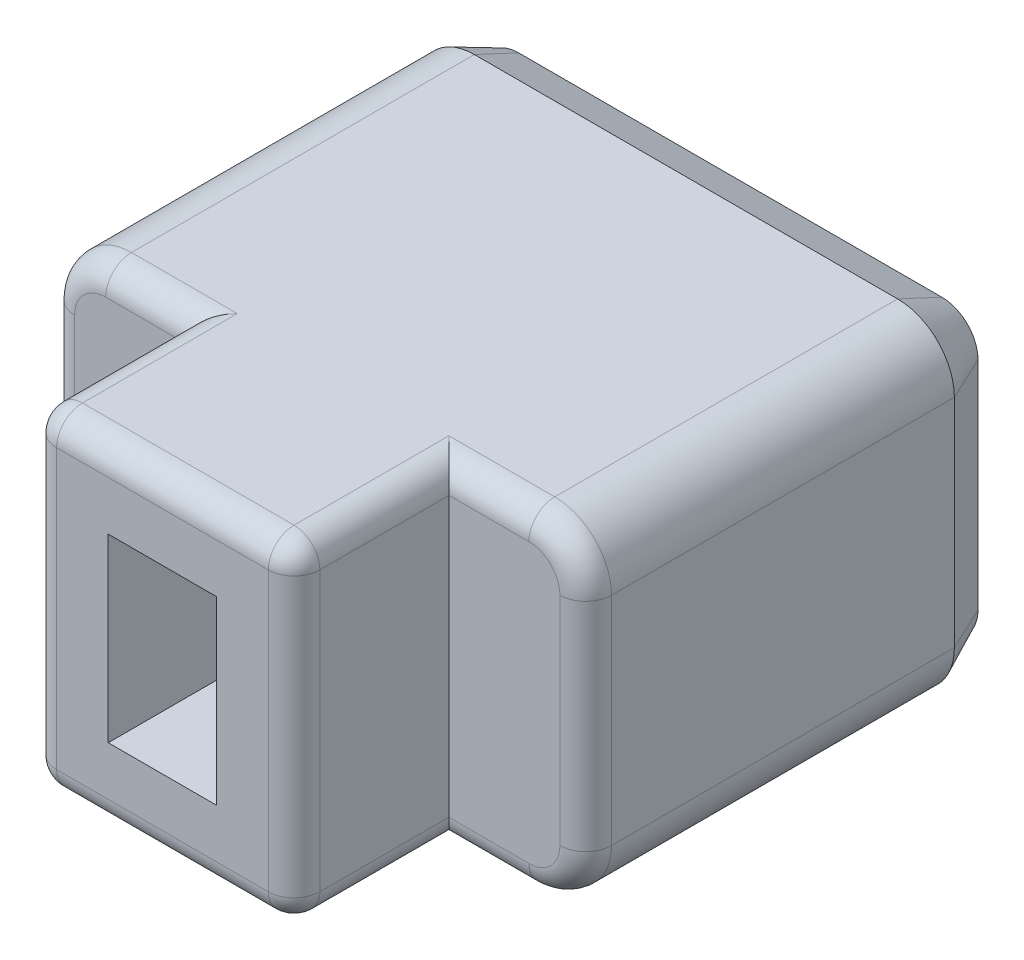
from build123d import *

# Parameters (mm, degrees)
BOSS_EXTRU_1_DEPTH      = 11
ESQUISSE3_W             = 2.1
ESQUISSE3_H             = 3.5
ENL_V_MAT_EXTRU_1_DEPTH = 3
ESQUISSE4_OUTSIDE_W     = 15.688
ESQUISSE4_OUTSIDE_H     = 11.688
ESQUISSE4_OUTSIDE_W_2   = 5.1
ESQUISSE4_OUTSIDE_H_2   = 6.4
ENL_V_MAT_EXTRU_2_DEPTH = 3
CONG_1_R                = 0.5
CHANFREIN1_SIZE         = 0.4
CHANFREIN1_SIZE2        = 0.857802768
ENL_V_MAT_EXTRU_3_DEPTH = 0.3
BOSS_EXTRU_2_DEPTH      = 0.3


with BuildPart() as part:
    # Esquisse2 → Boss.-Extru.1 (new body)
    with BuildSketch(Plane.XY):
        with BuildLine():
            Line((1.1, 0), (9.3, 0))
            ThreePointArc((9.3, 0), (10.077817459, 0.322182541), (10.4, 1.1))
            Line((10.4, 1.1), (10.4, 5.3))
            ThreePointArc((10.4, 5.3), (10.077817459, 6.077817459), (9.3, 6.4))
            Line((9.3, 6.4), (1.1, 6.4))
            ThreePointArc((1.1, 6.4), (0.322182541, 6.077817459), (0, 5.3))
            Line((0, 5.3), (0, 1.1))
            ThreePointArc((0, 1.1), (0.322182541, 0.322182541), (1.1, 0))
        make_face()
    extrude(amount=BOSS_EXTRU_1_DEPTH)

    # Esquisse3 → Enlèv. mat.-Extru.1 (cut)
    with BuildSketch(Plane.XY.offset(11)):
        with Locations((5.2, 3.2)):
            Rectangle(ESQUISSE3_W, ESQUISSE3_H)
    extrude(amount=-ENL_V_MAT_EXTRU_1_DEPTH, mode=Mode.SUBTRACT)

    # Esquisse4 outside → Enlèv. mat.-Extru.2 (cut)
    with BuildSketch(Plane.XY.offset(11)):
        with Locations((5.2, 3.2)):
            Rectangle(ESQUISSE4_OUTSIDE_W, ESQUISSE4_OUTSIDE_H)
        with Locations((5.2, 3.2)):
            Rectangle(ESQUISSE4_OUTSIDE_W_2, ESQUISSE4_OUTSIDE_H_2, mode=Mode.SUBTRACT)
    extrude(amount=-ENL_V_MAT_EXTRU_2_DEPTH, mode=Mode.SUBTRACT)

    # Congé1
    cong_1_edges = [part.edges().sort_by_distance(p)[0] for p in [
        (8.525, 0, 8),
        (10.077817459, 0.322182541, 8),
        (10.4, 3.2, 8),
        (10.077817459, 6.077817459, 8),
        (1.875, 6.4, 8),
        (0.322182541, 6.077817459, 8),
        (1.875, 0, 8),
        (0.322182541, 0.322182541, 8),
        (7.75, 6.4, 9.5),
        (2.65, 6.4, 9.5),
        (7.75, 0, 9.5),
        (2.65, 0, 9.5),
        (2.65, 3.2, 11),
        (5.2, 6.4, 11),
        (7.75, 3.2, 11),
        (5.2, 0, 11),
        (8.525, 6.4, 8),
        (0, 3.2, 8),
    ]]
    fillet(cong_1_edges, radius=CONG_1_R)

    # Chanfrein1
    chanfrein1_edges = [part.edges().sort_by_distance(p)[0] for p in [
        (5.2, 0, 0),
        (10.077817459, 0.322182541, 0),
        (0.322182541, 0.322182541, 0),
        (10.4, 3.2, 0),
        (0, 3.2, 0),
        (10.077817459, 6.077817459, 0),
        (0.322182541, 6.077817459, 0),
        (5.2, 6.4, 0),
    ]]
    chanfrein1_side = [part.faces().sort_by_distance(p)[0] for p in [
        (5.2, 3.2, 0),
    ]]
    chamfer(chanfrein1_edges, length=CHANFREIN1_SIZE, length2=CHANFREIN1_SIZE2, reference=chanfrein1_side[0])

    # Esquisse5 → Enlèv. mat.-Extru.3 (cut)
    with BuildSketch(Plane(origin=(0, 0, 0), x_dir=(-1, 0, 0), z_dir=(0, 0, -1))):
        with BuildLine():
            Line((-4.482051282, 2.223076923), (-4.123076923, 2.223076923))
            add(Edge.make_bspline(
                [(-4.123076923, 2.223076923), (-4.132172802, 2.182879821), (-4.149904355, 2.104519386), (-4.184689712, 1.991513998), (-4.225434495, 1.885765982), (-4.271957447, 1.78691387), (-4.323886866, 1.694871968), (-4.383007257, 1.610659662), (-4.446581457, 1.532228116), (-4.517727797, 1.463096907), (-4.591770568, 1.39996683), (-4.670710111, 1.346640876), (-4.752169587, 1.300230117), (-4.83719503, 1.262457843), (-4.925900563, 1.233638239), (-5.017876741, 1.21280939), (-5.113071631, 1.199496847), (-5.177787354, 1.198126712), (-5.210416667, 1.197435897)],
                knots=[0, 0, 0, 0, 1.213646873, 2.365889363, 3.479226314, 4.54912843, 5.581579656, 6.587705624, 7.576924878, 8.55050232, 9.505464024, 10.439453725, 11.351887816, 12.264152294, 13.174752891, 14.094686289, 15.039351257, 16, 16, 16, 16], degree=3))
            add(Edge.make_bspline(
                [(-5.210416667, 1.197435897), (-5.258094164, 1.199027149), (-5.352644116, 1.202182785), (-5.491403374, 1.230611249), (-5.625136021, 1.275963762), (-5.7524842, 1.338183678), (-5.870766075, 1.415281732), (-5.976128691, 1.506523979), (-6.066425025, 1.611076421), (-6.142330911, 1.726114044), (-6.202133725, 1.848818877), (-6.244814609, 1.975692907), (-6.271762849, 2.105224606), (-6.275198805, 2.192767116), (-6.276923077, 2.236698718)],
                knots=[0, 0, 0, 0, 1.037361841, 2.057207614, 3.07074694, 4.106133614, 5.135440569, 6.137362823, 7.131079132, 8.134553603, 9.130922184, 10.094788979, 11.043904817, 12, 12, 12, 12], degree=3))
            add(Edge.make_bspline(
                [(-6.276923077, 2.236698718), (-6.275539605, 2.278987452), (-6.272833897, 2.361693152), (-6.251540773, 2.482378728), (-6.216237816, 2.596400166), (-6.166137783, 2.703538574), (-6.102114735, 2.804087582), (-6.023690642, 2.897152494), (-5.931612715, 2.984047443), (-5.86169914, 3.033978011), (-5.825801282, 3.059615385)],
                knots=[0, 0, 0, 0, 1.034740432, 2.023681557, 2.989439786, 3.948891607, 4.910213012, 5.898894732, 6.921165452, 8, 8, 8, 8], degree=3))
            add(Edge.make_bspline(
                [(-5.825801282, 3.059615385), (-5.864137499, 3.080191012), (-5.940809934, 3.121342266), (-6.043507734, 3.202018162), (-6.138023166, 3.293734818), (-6.189768342, 3.364866735), (-6.216025641, 3.400961538)],
                knots=[0, 0, 0, 0, 0.994607769, 1.989215539, 2.979658163, 4, 4, 4, 4], degree=3))
            add(Edge.make_bspline(
                [(-6.216025641, 3.400961538), (-6.233356316, 3.427373686), (-6.26787002, 3.479972967), (-6.310391281, 3.563667495), (-6.347879736, 3.649096513), (-6.37822649, 3.736968961), (-6.401497955, 3.827322661), (-6.418276255, 3.919969224), (-6.429147626, 4.015018145), (-6.430226667, 4.079350901), (-6.430769231, 4.111698718)],
                knots=[0, 0, 0, 0, 1.00515716, 2.001751025, 2.984458985, 3.97420733, 4.958128942, 5.952324961, 6.970387383, 8, 8, 8, 8], degree=3))
            add(Edge.make_bspline(
                [(-6.430769231, 4.111698718), (-6.428743989, 4.167663613), (-6.42471183, 4.279086982), (-6.392790373, 4.444008829), (-6.342381333, 4.604955427), (-6.27195412, 4.75956667), (-6.18482671, 4.904129083), (-6.081145827, 5.033094403), (-5.962534477, 5.144582643), (-5.830197653, 5.237360691), (-5.68630887, 5.311534147), (-5.532868345, 5.364666879), (-5.370679404, 5.396859709), (-5.259709965, 5.400639474), (-5.203205128, 5.402564103)],
                knots=[0, 0, 0, 0, 1.014706638, 2.020231274, 3.036313833, 4.068571099, 5.094908553, 6.090824756, 7.060992088, 8.038345228, 9.013581893, 9.988228495, 10.975620497, 12, 12, 12, 12], degree=3))
            add(Edge.make_bspline(
                [(-5.203205128, 5.402564103), (-5.165246363, 5.401570424), (-5.090682463, 5.399618502), (-4.9810235, 5.386317129), (-4.876778256, 5.361480703), (-4.776379933, 5.330186609), (-4.681760311, 5.286956208), (-4.591303684, 5.235671401), (-4.506016772, 5.174294586), (-4.425884157, 5.103608562), (-4.351166433, 5.024051615), (-4.282737635, 4.935670934), (-4.222178503, 4.838072885), (-4.166983575, 4.732595618), (-4.120271063, 4.617488155), (-4.079407489, 4.494143595), (-4.045544141, 4.361842187), (-4.029014069, 4.270204999), (-4.020512821, 4.223076923)],
                knots=[0, 0, 0, 0, 0.990568784, 1.945813299, 2.875676271, 3.783761552, 4.685324092, 5.584377753, 6.493425385, 7.4218245, 8.36851308, 9.337390209, 10.333265409, 11.361963029, 12.440115797, 13.570763079, 14.750668092, 16, 16, 16, 16], degree=3))
            Line((-4.020512821, 4.223076923), (-4.379487179, 4.223076923))
            add(Edge.make_bspline(
                [(-4.379487179, 4.223076923), (-4.387118243, 4.253901726), (-4.401958094, 4.313845598), (-4.429866947, 4.399311139), (-4.45787412, 4.47900565), (-4.490311856, 4.551314604), (-4.524644529, 4.617265759), (-4.561464259, 4.677017538), (-4.601146872, 4.729940781), (-4.630535719, 4.760986514), (-4.644711538, 4.775961538)],
                knots=[0, 0, 0, 0, 1.227409514, 2.386898646, 3.474821375, 4.49196229, 5.448190758, 6.348047463, 7.203174547, 8, 8, 8, 8], degree=3))
            add(Edge.make_bspline(
                [(-4.644711538, 4.775961538), (-4.663625825, 4.793169329), (-4.701087137, 4.827250782), (-4.76262788, 4.8714789), (-4.82763193, 4.909502151), (-4.896789588, 4.939903316), (-4.969627615, 4.963233834), (-5.046089988, 4.979888915), (-5.126502917, 4.990788894), (-5.18153399, 4.991794533), (-5.209615385, 4.992307692)],
                knots=[0, 0, 0, 0, 0.987673777, 1.956169713, 2.922958465, 3.893597884, 4.869766497, 5.874185781, 6.915234169, 8, 8, 8, 8], degree=3))
            add(Edge.make_bspline(
                [(-5.209615385, 4.992307692), (-5.241448955, 4.991621354), (-5.303484394, 4.990283856), (-5.39400022, 4.977425049), (-5.480036376, 4.959232218), (-5.560686962, 4.930153903), (-5.637551649, 4.895417149), (-5.708737853, 4.850964488), (-5.775216799, 4.799002976), (-5.836422077, 4.74018012), (-5.89108324, 4.675557144), (-5.939388385, 4.608069597), (-5.980982451, 4.538169232), (-6.013333239, 4.464646611), (-6.040538243, 4.389136122), (-6.058770549, 4.310341705), (-6.069136276, 4.228963731), (-6.070902137, 4.173960727), (-6.071794872, 4.146153846)],
                knots=[0, 0, 0, 0, 1.131388683, 2.204785482, 3.246441662, 4.252851856, 5.247356788, 6.241181003, 7.22926868, 8.243715995, 9.254465245, 10.235036049, 11.192984918, 12.141087045, 13.087426855, 14.043631555, 15.010953923, 16, 16, 16, 16], degree=3))
            add(Edge.make_bspline(
                [(-6.071794872, 4.146153846), (-6.070425424, 4.108923192), (-6.06770243, 4.034894228), (-6.045263849, 3.925951777), (-6.008784671, 3.820693552), (-5.958785101, 3.720677931), (-5.896401591, 3.62841055), (-5.823392741, 3.547133882), (-5.740422622, 3.477841607), (-5.662765755, 3.43054886), (-5.593787365, 3.398821262), (-5.535204528, 3.377096108), (-5.469607981, 3.359132482), (-5.398017693, 3.342329942), (-5.319417432, 3.327809305), (-5.234365734, 3.316175248), (-5.142449502, 3.306375708), (-5.079025259, 3.302176407), (-5.046153846, 3.3)],
                knots=[0, 0, 0, 0, 1.192805178, 2.371758753, 3.549810072, 4.756155874, 5.946098869, 7.110280517, 8.247279574, 9.400162675, 10.013208869, 10.679725361, 11.400782005, 12.192190353, 13.037020936, 13.96226458, 14.943885823, 16, 16, 16, 16], degree=3))
            Line((-5.046153846, 3.3), (-5.046153846, 2.88974359))
            add(Edge.make_bspline(
                [(-5.046153846, 2.88974359), (-5.088150562, 2.888762199), (-5.170660543, 2.886834082), (-5.291308641, 2.868815079), (-5.406306817, 2.839057635), (-5.513901263, 2.797793619), (-5.611837507, 2.748050326), (-5.697356677, 2.691251666), (-5.767743193, 2.626744832), (-5.823945861, 2.556359146), (-5.865824484, 2.480980159), (-5.89566742, 2.40214926), (-5.91522079, 2.319915292), (-5.917034619, 2.263518126), (-5.917948718, 2.235096154)],
                knots=[0, 0, 0, 0, 1.243616131, 2.44330398, 3.604505843, 4.75669394, 5.850271017, 6.853290421, 7.788562808, 8.667255455, 9.510416964, 10.331949075, 11.159367386, 12, 12, 12, 12], degree=3))
            add(Edge.make_bspline(
                [(-5.917948718, 2.235096154), (-5.91735912, 2.214221522), (-5.916188689, 2.172782552), (-5.906034732, 2.111908452), (-5.891099605, 2.052952656), (-5.869264862, 1.996484401), (-5.840766114, 1.942387341), (-5.80637209, 1.890106875), (-5.764855489, 1.840569584), (-5.7192227, 1.792655284), (-5.667906556, 1.74940941), (-5.612600183, 1.712031857), (-5.554359317, 1.679379127), (-5.492850933, 1.6530839), (-5.42784051, 1.632866221), (-5.359681028, 1.618661468), (-5.288113774, 1.609612794), (-5.239290185, 1.608340381), (-5.214423077, 1.607692308)],
                knots=[0, 0, 0, 0, 0.95422432, 1.894264499, 2.815862866, 3.732507896, 4.656047834, 5.60823639, 6.589073805, 7.608638867, 8.631711616, 9.651715799, 10.65801814, 11.681528505, 12.705549186, 13.767074307, 14.862713597, 16, 16, 16, 16], degree=3))
            add(Edge.make_bspline(
                [(-5.214423077, 1.607692308), (-5.174463142, 1.609275267), (-5.096292971, 1.612371873), (-4.983725649, 1.639891651), (-4.879168109, 1.683156126), (-4.800266567, 1.735429254), (-4.742005947, 1.786360527), (-4.699530846, 1.830715578), (-4.658184177, 1.880805783), (-4.619294171, 1.937517388), (-4.582737756, 2.0006376), (-4.546195196, 2.068600834), (-4.512748799, 2.143503144), (-4.492494915, 2.196005048), (-4.482051282, 2.223076923)],
                knots=[0, 0, 0, 0, 1.395667895, 2.730224622, 4.027984045, 5.336391174, 6.018318975, 6.731826814, 7.481767641, 8.28762907, 9.133535766, 10.031970229, 10.985212891, 12, 12, 12, 12], degree=3))
        make_face()
    extrude(amount=-ENL_V_MAT_EXTRU_3_DEPTH, mode=Mode.SUBTRACT)


with BuildPart() as body_2:
    # Esquisse5<2> → Boss.-Extru.2 (new body)
    with BuildSketch(Plane(origin=(0, 0, 0), x_dir=(-1, 0, 0), z_dir=(0, 0, -1))):
        with BuildLine():
            Line((-4.482051282, 2.223076923), (-4.123076923, 2.223076923))
            add(Edge.make_bspline(
                [(-4.123076923, 2.223076923), (-4.132172802, 2.182879821), (-4.149904355, 2.104519386), (-4.184689712, 1.991513998), (-4.225434495, 1.885765982), (-4.271957447, 1.78691387), (-4.323886866, 1.694871968), (-4.383007257, 1.610659662), (-4.446581457, 1.532228116), (-4.517727797, 1.463096907), (-4.591770568, 1.39996683), (-4.670710111, 1.346640876), (-4.752169587, 1.300230117), (-4.83719503, 1.262457843), (-4.925900563, 1.233638239), (-5.017876741, 1.21280939), (-5.113071631, 1.199496847), (-5.177787354, 1.198126712), (-5.210416667, 1.197435897)],
                knots=[0, 0, 0, 0, 1.213646873, 2.365889363, 3.479226314, 4.54912843, 5.581579656, 6.587705624, 7.576924878, 8.55050232, 9.505464024, 10.439453725, 11.351887816, 12.264152294, 13.174752891, 14.094686289, 15.039351257, 16, 16, 16, 16], degree=3))
            add(Edge.make_bspline(
                [(-5.210416667, 1.197435897), (-5.258094164, 1.199027149), (-5.352644116, 1.202182785), (-5.491403374, 1.230611249), (-5.625136021, 1.275963762), (-5.7524842, 1.338183678), (-5.870766075, 1.415281732), (-5.976128691, 1.506523979), (-6.066425025, 1.611076421), (-6.142330911, 1.726114044), (-6.202133725, 1.848818877), (-6.244814609, 1.975692907), (-6.271762849, 2.105224606), (-6.275198805, 2.192767116), (-6.276923077, 2.236698718)],
                knots=[0, 0, 0, 0, 1.037361841, 2.057207614, 3.07074694, 4.106133614, 5.135440569, 6.137362823, 7.131079132, 8.134553603, 9.130922184, 10.094788979, 11.043904817, 12, 12, 12, 12], degree=3))
            add(Edge.make_bspline(
                [(-6.276923077, 2.236698718), (-6.275539605, 2.278987452), (-6.272833897, 2.361693152), (-6.251540773, 2.482378728), (-6.216237816, 2.596400166), (-6.166137783, 2.703538574), (-6.102114735, 2.804087582), (-6.023690642, 2.897152494), (-5.931612715, 2.984047443), (-5.86169914, 3.033978011), (-5.825801282, 3.059615385)],
                knots=[0, 0, 0, 0, 1.034740432, 2.023681557, 2.989439786, 3.948891607, 4.910213012, 5.898894732, 6.921165452, 8, 8, 8, 8], degree=3))
            add(Edge.make_bspline(
                [(-5.825801282, 3.059615385), (-5.864137499, 3.080191012), (-5.940809934, 3.121342266), (-6.043507734, 3.202018162), (-6.138023166, 3.293734818), (-6.189768342, 3.364866735), (-6.216025641, 3.400961538)],
                knots=[0, 0, 0, 0, 0.994607769, 1.989215539, 2.979658163, 4, 4, 4, 4], degree=3))
            add(Edge.make_bspline(
                [(-6.216025641, 3.400961538), (-6.233356316, 3.427373686), (-6.26787002, 3.479972967), (-6.310391281, 3.563667495), (-6.347879736, 3.649096513), (-6.37822649, 3.736968961), (-6.401497955, 3.827322661), (-6.418276255, 3.919969224), (-6.429147626, 4.015018145), (-6.430226667, 4.079350901), (-6.430769231, 4.111698718)],
                knots=[0, 0, 0, 0, 1.00515716, 2.001751025, 2.984458985, 3.97420733, 4.958128942, 5.952324961, 6.970387383, 8, 8, 8, 8], degree=3))
            add(Edge.make_bspline(
                [(-6.430769231, 4.111698718), (-6.428743989, 4.167663613), (-6.42471183, 4.279086982), (-6.392790373, 4.444008829), (-6.342381333, 4.604955427), (-6.27195412, 4.75956667), (-6.18482671, 4.904129083), (-6.081145827, 5.033094403), (-5.962534477, 5.144582643), (-5.830197653, 5.237360691), (-5.68630887, 5.311534147), (-5.532868345, 5.364666879), (-5.370679404, 5.396859709), (-5.259709965, 5.400639474), (-5.203205128, 5.402564103)],
                knots=[0, 0, 0, 0, 1.014706638, 2.020231274, 3.036313833, 4.068571099, 5.094908553, 6.090824756, 7.060992088, 8.038345228, 9.013581893, 9.988228495, 10.975620497, 12, 12, 12, 12], degree=3))
            add(Edge.make_bspline(
                [(-5.203205128, 5.402564103), (-5.165246363, 5.401570424), (-5.090682463, 5.399618502), (-4.9810235, 5.386317129), (-4.876778256, 5.361480703), (-4.776379933, 5.330186609), (-4.681760311, 5.286956208), (-4.591303684, 5.235671401), (-4.506016772, 5.174294586), (-4.425884157, 5.103608562), (-4.351166433, 5.024051615), (-4.282737635, 4.935670934), (-4.222178503, 4.838072885), (-4.166983575, 4.732595618), (-4.120271063, 4.617488155), (-4.079407489, 4.494143595), (-4.045544141, 4.361842187), (-4.029014069, 4.270204999), (-4.020512821, 4.223076923)],
                knots=[0, 0, 0, 0, 0.990568784, 1.945813299, 2.875676271, 3.783761552, 4.685324092, 5.584377753, 6.493425385, 7.4218245, 8.36851308, 9.337390209, 10.333265409, 11.361963029, 12.440115797, 13.570763079, 14.750668092, 16, 16, 16, 16], degree=3))
            Line((-4.020512821, 4.223076923), (-4.379487179, 4.223076923))
            add(Edge.make_bspline(
                [(-4.379487179, 4.223076923), (-4.387118243, 4.253901726), (-4.401958094, 4.313845598), (-4.429866947, 4.399311139), (-4.45787412, 4.47900565), (-4.490311856, 4.551314604), (-4.524644529, 4.617265759), (-4.561464259, 4.677017538), (-4.601146872, 4.729940781), (-4.630535719, 4.760986514), (-4.644711538, 4.775961538)],
                knots=[0, 0, 0, 0, 1.227409514, 2.386898646, 3.474821375, 4.49196229, 5.448190758, 6.348047463, 7.203174547, 8, 8, 8, 8], degree=3))
            add(Edge.make_bspline(
                [(-4.644711538, 4.775961538), (-4.663625825, 4.793169329), (-4.701087137, 4.827250782), (-4.76262788, 4.8714789), (-4.82763193, 4.909502151), (-4.896789588, 4.939903316), (-4.969627615, 4.963233834), (-5.046089988, 4.979888915), (-5.126502917, 4.990788894), (-5.18153399, 4.991794533), (-5.209615385, 4.992307692)],
                knots=[0, 0, 0, 0, 0.987673777, 1.956169713, 2.922958465, 3.893597884, 4.869766497, 5.874185781, 6.915234169, 8, 8, 8, 8], degree=3))
            add(Edge.make_bspline(
                [(-5.209615385, 4.992307692), (-5.241448955, 4.991621354), (-5.303484394, 4.990283856), (-5.39400022, 4.977425049), (-5.480036376, 4.959232218), (-5.560686962, 4.930153903), (-5.637551649, 4.895417149), (-5.708737853, 4.850964488), (-5.775216799, 4.799002976), (-5.836422077, 4.74018012), (-5.89108324, 4.675557144), (-5.939388385, 4.608069597), (-5.980982451, 4.538169232), (-6.013333239, 4.464646611), (-6.040538243, 4.389136122), (-6.058770549, 4.310341705), (-6.069136276, 4.228963731), (-6.070902137, 4.173960727), (-6.071794872, 4.146153846)],
                knots=[0, 0, 0, 0, 1.131388683, 2.204785482, 3.246441662, 4.252851856, 5.247356788, 6.241181003, 7.22926868, 8.243715995, 9.254465245, 10.235036049, 11.192984918, 12.141087045, 13.087426855, 14.043631555, 15.010953923, 16, 16, 16, 16], degree=3))
            add(Edge.make_bspline(
                [(-6.071794872, 4.146153846), (-6.070425424, 4.108923192), (-6.06770243, 4.034894228), (-6.045263849, 3.925951777), (-6.008784671, 3.820693552), (-5.958785101, 3.720677931), (-5.896401591, 3.62841055), (-5.823392741, 3.547133882), (-5.740422622, 3.477841607), (-5.662765755, 3.43054886), (-5.593787365, 3.398821262), (-5.535204528, 3.377096108), (-5.469607981, 3.359132482), (-5.398017693, 3.342329942), (-5.319417432, 3.327809305), (-5.234365734, 3.316175248), (-5.142449502, 3.306375708), (-5.079025259, 3.302176407), (-5.046153846, 3.3)],
                knots=[0, 0, 0, 0, 1.192805178, 2.371758753, 3.549810072, 4.756155874, 5.946098869, 7.110280517, 8.247279574, 9.400162675, 10.013208869, 10.679725361, 11.400782005, 12.192190353, 13.037020936, 13.96226458, 14.943885823, 16, 16, 16, 16], degree=3))
            Line((-5.046153846, 3.3), (-5.046153846, 2.88974359))
            add(Edge.make_bspline(
                [(-5.046153846, 2.88974359), (-5.088150562, 2.888762199), (-5.170660543, 2.886834082), (-5.291308641, 2.868815079), (-5.406306817, 2.839057635), (-5.513901263, 2.797793619), (-5.611837507, 2.748050326), (-5.697356677, 2.691251666), (-5.767743193, 2.626744832), (-5.823945861, 2.556359146), (-5.865824484, 2.480980159), (-5.89566742, 2.40214926), (-5.91522079, 2.319915292), (-5.917034619, 2.263518126), (-5.917948718, 2.235096154)],
                knots=[0, 0, 0, 0, 1.243616131, 2.44330398, 3.604505843, 4.75669394, 5.850271017, 6.853290421, 7.788562808, 8.667255455, 9.510416964, 10.331949075, 11.159367386, 12, 12, 12, 12], degree=3))
            add(Edge.make_bspline(
                [(-5.917948718, 2.235096154), (-5.91735912, 2.214221522), (-5.916188689, 2.172782552), (-5.906034732, 2.111908452), (-5.891099605, 2.052952656), (-5.869264862, 1.996484401), (-5.840766114, 1.942387341), (-5.80637209, 1.890106875), (-5.764855489, 1.840569584), (-5.7192227, 1.792655284), (-5.667906556, 1.74940941), (-5.612600183, 1.712031857), (-5.554359317, 1.679379127), (-5.492850933, 1.6530839), (-5.42784051, 1.632866221), (-5.359681028, 1.618661468), (-5.288113774, 1.609612794), (-5.239290185, 1.608340381), (-5.214423077, 1.607692308)],
                knots=[0, 0, 0, 0, 0.95422432, 1.894264499, 2.815862866, 3.732507896, 4.656047834, 5.60823639, 6.589073805, 7.608638867, 8.631711616, 9.651715799, 10.65801814, 11.681528505, 12.705549186, 13.767074307, 14.862713597, 16, 16, 16, 16], degree=3))
            add(Edge.make_bspline(
                [(-5.214423077, 1.607692308), (-5.174463142, 1.609275267), (-5.096292971, 1.612371873), (-4.983725649, 1.639891651), (-4.879168109, 1.683156126), (-4.800266567, 1.735429254), (-4.742005947, 1.786360527), (-4.699530846, 1.830715578), (-4.658184177, 1.880805783), (-4.619294171, 1.937517388), (-4.582737756, 2.0006376), (-4.546195196, 2.068600834), (-4.512748799, 2.143503144), (-4.492494915, 2.196005048), (-4.482051282, 2.223076923)],
                knots=[0, 0, 0, 0, 1.395667895, 2.730224622, 4.027984045, 5.336391174, 6.018318975, 6.731826814, 7.481767641, 8.28762907, 9.133535766, 10.031970229, 10.985212891, 12, 12, 12, 12], degree=3))
        make_face()
    extrude(amount=BOSS_EXTRU_2_DEPTH)


solid = Compound([part.part, body_2.part])
